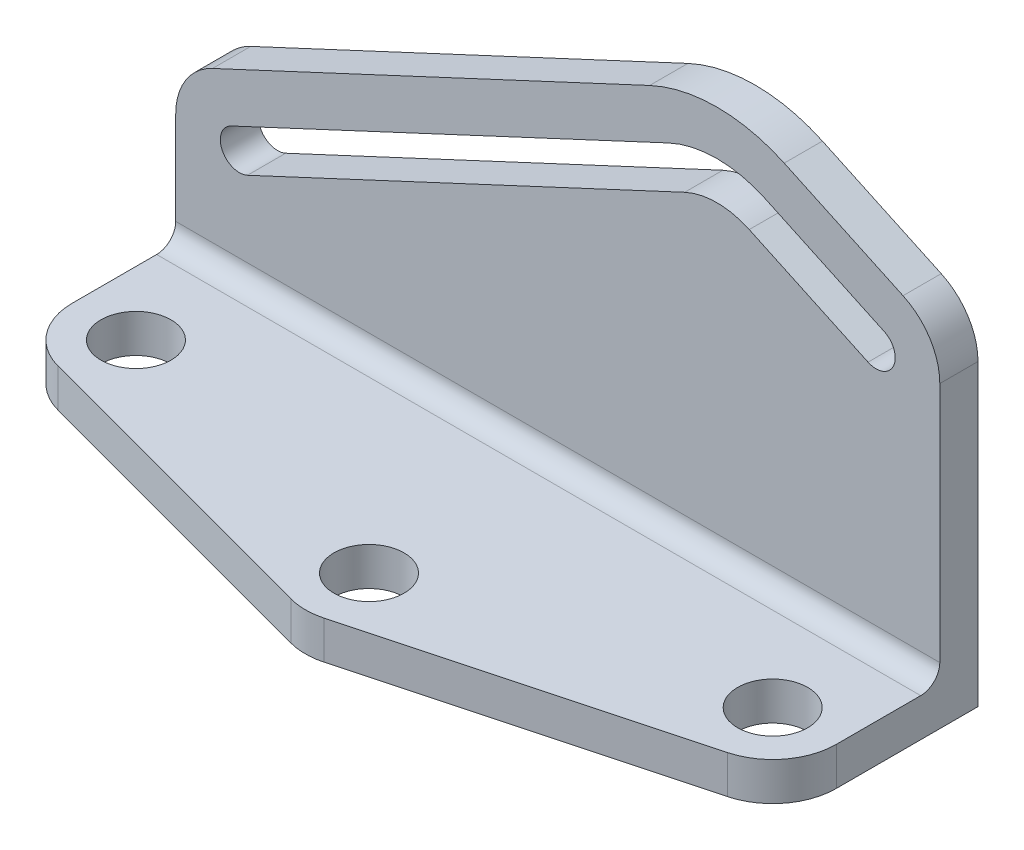
from build123d import *

# Parameters (mm, degrees)
EXTRUDE_1_DEPTH     = 6
SKETCH_2_R          = 5.5
EXTRUDE_2_DEPTH     = 6
FILLET_1_R          = 3
CUT_EXTRUDE_1_DEPTH = 99.325146161


with BuildPart() as part:
    # Эскиз1 → Бобышка-Вытянуть1 (new body)
    with BuildSketch(Plane.XY):
        with BuildLine():
            Line((-60, 0), (-60, 23.629297392))
            ThreePointArc((-60, 23.629297392), (-58.433914458, 29.002293475), (-54.226182617, 32.692375262))
            Line((-54.226182617, 32.692375262), (14.434543456, 64.709397645))
            ThreePointArc((14.434543456, 64.709397645), (25, 67.051702969), (35.565456544, 64.709397645))
            Line((35.565456544, 64.709397645), (54.226182617, 56.00775817))
            ThreePointArc((54.226182617, 56.00775817), (58.433914458, 52.317676383), (60, 46.9446803))
            Line((60, 46.9446803), (60, 0))
            Line((60, 0), (-60, 0))
        make_face()
    extrude(amount=EXTRUDE_1_DEPTH)

    # Эскиз2 → Бобышка-Вытянуть2 (add)
    with BuildSketch(Plane.XZ):
        with BuildLine():
            Line((-60, 6), (60, 6))
            Line((60, 6), (60, 22.249778574))
            ThreePointArc((60, 22.249778574), (57.933533403, 28.337392864), (52.588190451, 31.909036837))
            Line((52.588190451, 31.909036837), (2.588190451, 45.306496459))
            ThreePointArc((2.588190451, 45.306496459), (0, 45.647238196), (-2.588190451, 45.306496459))
            Line((-2.588190451, 45.306496459), (-52.588190451, 31.909036837))
            ThreePointArc((-52.588190451, 31.909036837), (-57.933533403, 28.337392864), (-60, 22.249778574))
            Line((-60, 22.249778574), (-60, 6))
        make_face()
        with Locations(Location((-50, 22.249778574, 0), (0, 0, 270))):
            Circle(SKETCH_2_R, mode=Mode.SUBTRACT)
        with Locations(Location((0, 35.647238196, 0), (0, 0, 270))):
            Circle(SKETCH_2_R, mode=Mode.SUBTRACT)
        with Locations(Location((50, 22.249778574, 0), (0, 0, 270))):
            Circle(SKETCH_2_R, mode=Mode.SUBTRACT)
    extrude(amount=-EXTRUDE_2_DEPTH)

    # Скругление1
    fillet_1_edges = [part.edges().sort_by_distance(p)[0] for p in [
        (0, 6, 6),
    ]]
    fillet(fillet_1_edges, radius=FILLET_1_R)

    # Эскиз3 → Вырез-Вытянуть1 (cut, through all)
    with BuildSketch(Plane.XY.offset(6)):
        with BuildLine():
            Line((51.267854785, 49.663603661), (32.607128711, 58.365243136))
            ThreePointArc((32.607128711, 58.365243136), (25, 60.051702969), (17.392871289, 58.365243136))
            Line((17.392871289, 58.365243136), (-51.267854785, 26.348220753))
            ThreePointArc((-51.267854785, 26.348220753), (-52.718923361, 22.361442607), (-48.732145215, 20.910374031))
            Line((-48.732145215, 20.910374031), (19.928580859, 52.927396414))
            ThreePointArc((19.928580859, 52.927396414), (25, 54.051702969), (30.071419141, 52.927396414))
            Line((30.071419141, 52.927396414), (48.732145215, 44.225756939))
            ThreePointArc((48.732145215, 44.225756939), (52.718923361, 45.676825514), (51.267854785, 49.663603661))
        make_face()
    extrude(amount=-CUT_EXTRUDE_1_DEPTH, mode=Mode.SUBTRACT)


solid = part.part
